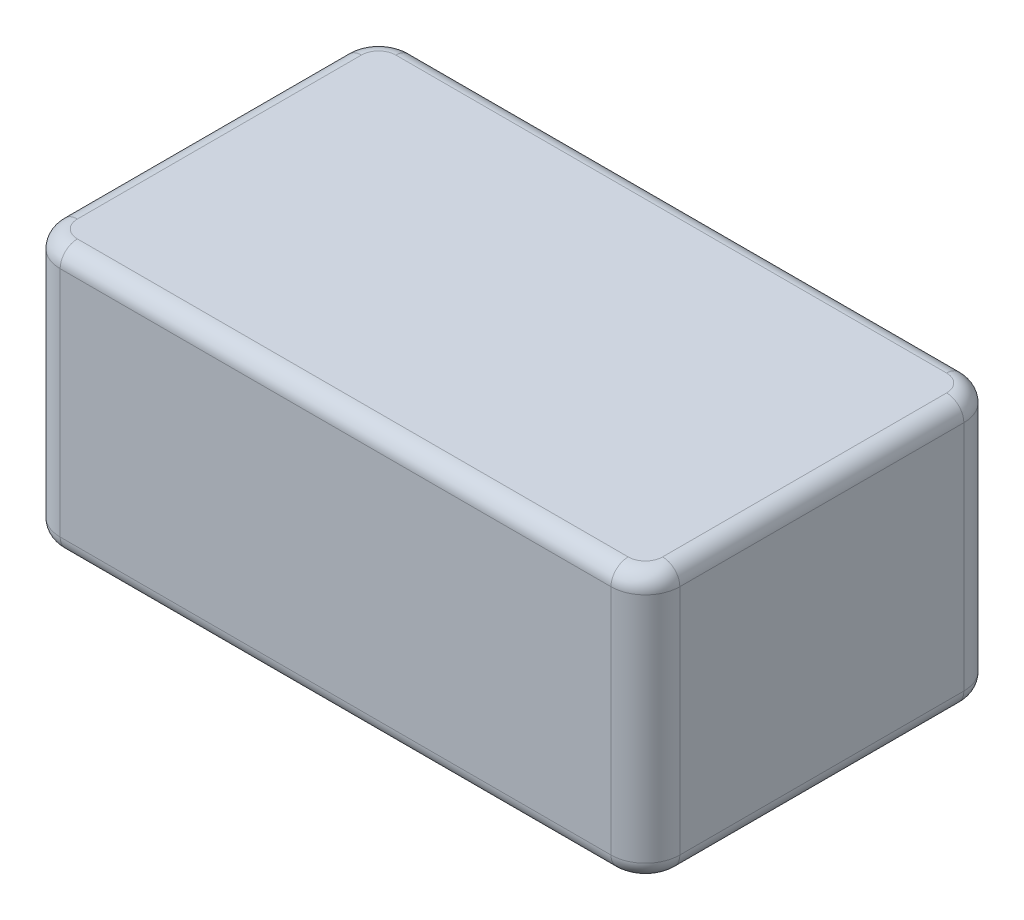
from build123d import *

# Parameters (mm, degrees)
SKETCH1_W           = 36
SKETCH1_H           = 20.5
BOSS_EXTRUDE1_DEPTH = 15.5
FILLET1_R           = 2
FILLET2_R           = 1


with BuildPart() as part:
    # Sketch1 → Boss-Extrude1 (new body)
    with BuildSketch(Plane(origin=(0, 0, 0), x_dir=(1, 0, 0), z_dir=(0, 1, 0))):
        with Locations((18, 10.25)):
            Rectangle(SKETCH1_W, SKETCH1_H)
    extrude(amount=BOSS_EXTRUDE1_DEPTH)

    # Fillet1
    fillet1_edges = [part.edges().sort_by_distance(p)[0] for p in [
        (0, 7.75, -20.5),
        (36, 7.75, -20.5),
        (36, 7.75, 0),
        (0, 7.75, 0),
    ]]
    fillet(fillet1_edges, radius=FILLET1_R)

    # Fillet2
    fillet2_edges = [part.edges().sort_by_distance(p)[0] for p in [
        (0, 0, -10.25),
        (0, 15.5, -10.25),
        (18, 0, -20.5),
        (36, 0, -10.25),
        (18, 0, 0),
        (0.585786438, 0, -0.585786438),
        (35.414213562, 0, -0.585786438),
        (35.414213562, 0, -19.914213562),
        (0.585786438, 0, -19.914213562),
        (18, 15.5, -20.5),
        (18, 15.5, 0),
        (36, 15.5, -10.25),
        (0.585786438, 15.5, -0.585786438),
        (35.414213562, 15.5, -0.585786438),
        (35.414213562, 15.5, -19.914213562),
        (0.585786438, 15.5, -19.914213562),
    ]]
    fillet(fillet2_edges, radius=FILLET2_R)


solid = part.part
